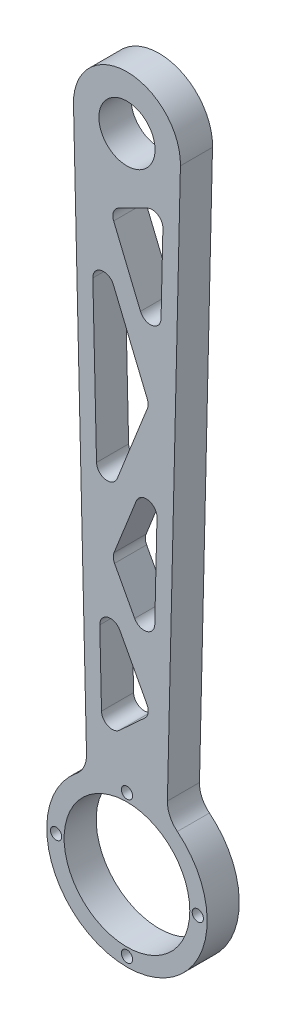
from build123d import *

# Parameters (mm, degrees)
EXTRUDE_1_DEPTH     = 12
SKETCH_2_R          = 10.5
SKETCH_2_R_2        = 23.5
CUT_EXTRUDE_1_DEPTH = 39
FILLET_1_R          = 10
SKETCH_3_R          = 2.1
CUT_EXTRUDE_2_DEPTH = 68
CUT_EXTRUDE_3_DEPTH = 263
FILLET_3_R          = 4


with BuildPart() as part:
    # 草图1 → 凸台-拉伸1 (new body)
    with BuildSketch(Plane.XY):
        with BuildLine():
            Line((-15, 25.980762114), (-19.994532285, 239.532369068))
            ThreePointArc((-19.994532285, 239.532369068), (0, 260), (19.994532285, 239.532369068))
            Line((19.994532285, 239.532369068), (15, 25.980762114))
            ThreePointArc((15, 25.980762114), (0, -30), (-15, 25.980762114))
        make_face()
    extrude(amount=EXTRUDE_1_DEPTH)

    # 草图2 → 切除-拉伸1 (cut)
    with BuildSketch(Plane.XY.offset(12)):
        with Locations((0, 240)):
            Circle(SKETCH_2_R)
        Circle(SKETCH_2_R_2)
    extrude(amount=-CUT_EXTRUDE_1_DEPTH, mode=Mode.SUBTRACT)

    # 圆角1
    fillet_1_edges = [part.edges().sort_by_distance(p)[0] for p in [
        (15, 25.980762114, 6),
        (-15, 25.980762114, 6),
    ]]
    fillet(fillet_1_edges, radius=FILLET_1_R)

    # 草图3 → 切除-拉伸2 (cut)
    with BuildSketch(Plane.XY.offset(12)):
        with Locations((0, 26.5)):
            Circle(SKETCH_3_R)
        with Locations((26.5, 0)):
            Circle(SKETCH_3_R)
        with Locations((0, -26.5)):
            Circle(SKETCH_3_R)
        with Locations((-26.5, 0)):
            Circle(SKETCH_3_R)
    extrude(amount=-CUT_EXTRUDE_2_DEPTH, mode=Mode.SUBTRACT)

    # 草图6 → 切除-拉伸3 (cut, through all)
    with BuildSketch(Plane(origin=(0, 0, 0), x_dir=(-1, 0, 0), z_dir=(0, 0, -1))):
        Polygon((-13.597448285, 222.62437169), (6.396098914, 212.643766677), (-12.305308581, 167.376253439), align=None)
        Polygon((13.262733731, 208.312955361), (-8.237709541, 156.270262815), (10.920628657, 108.171385833), align=None)
        Polygon((-11.745923389, 143.458577117), (5.525281493, 100.097532419), (-10.051201509, 70.997221333), align=None)
        Polygon((-8.948192405, 56.105719255), (10.555093379, 92.542165366), (9.310631693, 39.332619917), align=None)
    extrude(amount=-CUT_EXTRUDE_3_DEPTH, mode=Mode.SUBTRACT)

    # 圆角3
    fillet_3_edges = [part.edges().sort_by_distance(p)[0] for p in [
        (10.051201509, 70.997221333, 6),
        (11.745923389, 143.458577117, 6),
        (-5.525281493, 100.097532419, 6),
        (-13.262733731, 208.312955361, 6),
        (-10.920628657, 108.171385833, 6),
        (8.237709541, 156.270262815, 6),
        (-9.310631693, 39.332619917, 6),
        (8.948192405, 56.105719255, 6),
        (-10.555093379, 92.542165366, 6),
        (12.305308581, 167.376253439, 6),
        (13.597448285, 222.62437169, 6),
        (-6.396098914, 212.643766677, 6),
    ]]
    fillet(fillet_3_edges, radius=FILLET_3_R)


solid = part.part
